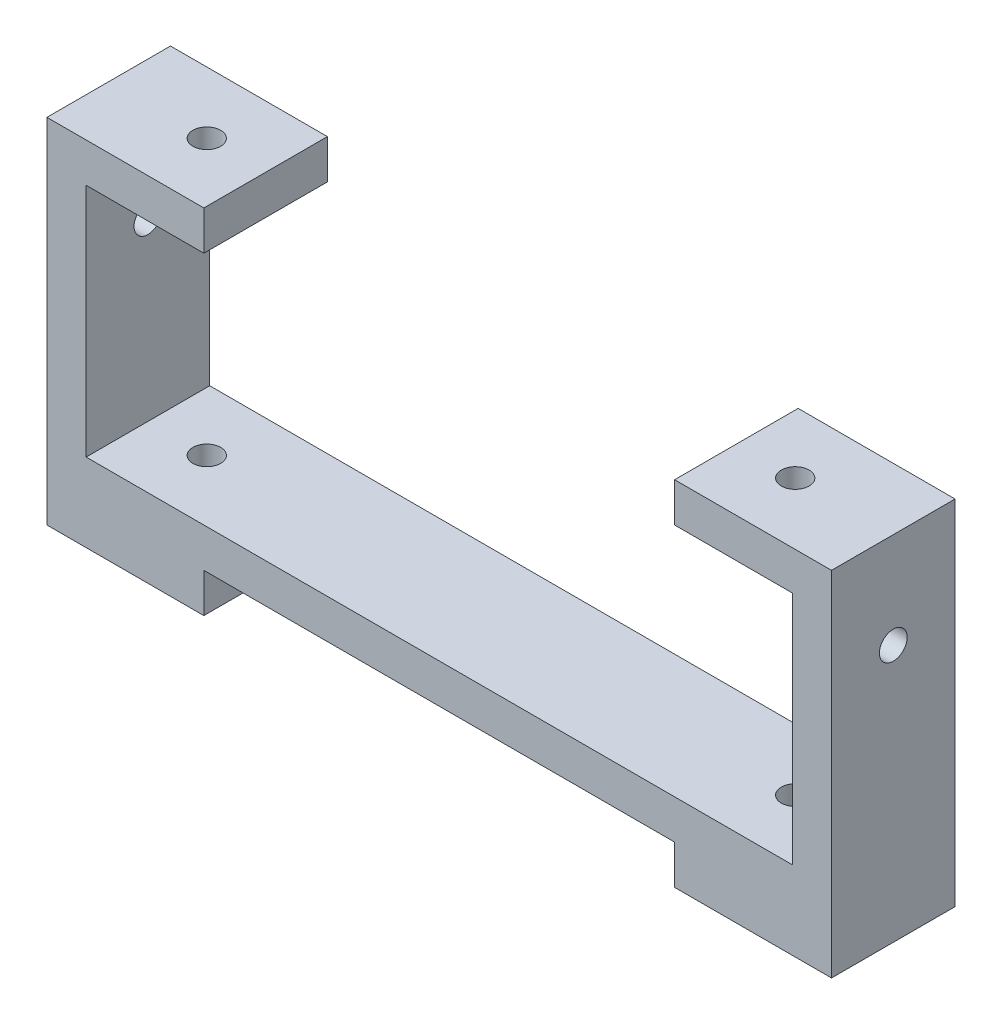
from build123d import *

# Parameters (mm, degrees)
BOSS_EXTRUDE1_DEPTH = 10
CUT_EXTRUDE1_REACH  = 80.154
SKETCH2_R           = 2.25
CUT_EXTRUDE2_REACH  = 130.406
SKETCH3_R           = 2.25
CUT_EXTRUDE3_REACH  = 83.932
SKETCH4_R           = 2.25
CUT_EXTRUDE4_REACH  = 130.406
SKETCH5_R           = 2.25


with BuildPart() as part:
    # Sketch1 → Boss-Extrude1 (new, symmetric)
    with BuildSketch(Plane.XY):
        Polygon((-57.15, -1.651), (-57.15, 36.449), (-38.1, 36.449), (-38.1, 42.799), (-63.5, 42.799), (-63.5, -3.175), (-63.5, -14.351), (-38.1, -14.351), (-38.1, -8.001), (38.1, -8.001), (38.1, -14.351), (63.5, -14.351), (63.5, -3.175), (63.5, 42.799), (38.1, 42.799), (38.1, 36.449), (57.15, 36.449), (57.15, -1.651), align=None)
    extrude(amount=BOSS_EXTRUDE1_DEPTH, both=True)

    # Sketch2 → Cut-Extrude1 (cut, up to next)
    with BuildSketch(Plane(origin=(0, -1.651, 0), x_dir=(1, 0, 0), z_dir=(0, 1, 0)), mode=Mode.PRIVATE) as cut_extrude1_sk1:
        with Locations(Location((-47.625, 0, 0), (0, 0, 270))):
            Circle(SKETCH2_R)
    cut_extrude1_tool1 = extrude(cut_extrude1_sk1.sketch, amount=-CUT_EXTRUDE1_REACH, mode=Mode.PRIVATE) & part.part
    # Sketch2 → Cut-Extrude1 (cut, up to next)
    with BuildSketch(Plane(origin=(0, -1.651, 0), x_dir=(1, 0, 0), z_dir=(0, 1, 0)), mode=Mode.PRIVATE) as cut_extrude1_sk2:
        with Locations(Location((47.625, 0, 0), (0, 0, 180))):
            Circle(SKETCH2_R)
    cut_extrude1_tool2 = extrude(cut_extrude1_sk2.sketch, amount=-CUT_EXTRUDE1_REACH, mode=Mode.PRIVATE) & part.part
    add(cut_extrude1_tool1.solids().sort_by_distance((-47.625, -1.651, 0))[0], mode=Mode.SUBTRACT)
    add(cut_extrude1_tool2.solids().sort_by_distance((47.625, -1.651, 0))[0], mode=Mode.SUBTRACT)

    # Sketch3 → Cut-Extrude2 (cut, up to next)
    with BuildSketch(Plane(origin=(-57.15, 0, 0), x_dir=(0, 0, -1), z_dir=(1, 0, 0)), mode=Mode.PRIVATE) as cut_extrude2_sk1:
        with Locations(Location((0, 26.797, 0), (0, 0, 90))):
            Circle(SKETCH3_R)
    cut_extrude2_tool1 = extrude(cut_extrude2_sk1.sketch, amount=-CUT_EXTRUDE2_REACH, mode=Mode.PRIVATE) & part.part
    add(cut_extrude2_tool1.solids().sort_by_distance((-57.15, 26.797, 0))[0], mode=Mode.SUBTRACT)

    # Sketch4 → Cut-Extrude3 (cut, up to next)
    with BuildSketch(Plane.XZ.offset(-36.449), mode=Mode.PRIVATE) as cut_extrude3_sk1:
        with Locations(Location((-47.625, 0, 0), (0, 0, 90))):
            Circle(SKETCH4_R)
    cut_extrude3_tool1 = extrude(cut_extrude3_sk1.sketch, amount=-CUT_EXTRUDE3_REACH, mode=Mode.PRIVATE) & part.part
    # Sketch4 → Cut-Extrude3 (cut, up to next)
    with BuildSketch(Plane.XZ.offset(-36.449), mode=Mode.PRIVATE) as cut_extrude3_sk2:
        with Locations(Location((47.625, 0, 0), (0, 0, 180))):
            Circle(SKETCH4_R)
    cut_extrude3_tool2 = extrude(cut_extrude3_sk2.sketch, amount=-CUT_EXTRUDE3_REACH, mode=Mode.PRIVATE) & part.part
    add(cut_extrude3_tool1.solids().sort_by_distance((-47.625, 36.449, 0))[0], mode=Mode.SUBTRACT)
    add(cut_extrude3_tool2.solids().sort_by_distance((47.625, 36.449, 0))[0], mode=Mode.SUBTRACT)

    # Sketch5 → Cut-Extrude4 (cut, up to next)
    with BuildSketch(Plane.ZY.offset(-57.15), mode=Mode.PRIVATE) as cut_extrude4_sk1:
        with Locations((0, 27.305)):
            Circle(SKETCH5_R)
    cut_extrude4_tool1 = extrude(cut_extrude4_sk1.sketch, amount=-CUT_EXTRUDE4_REACH, mode=Mode.PRIVATE) & part.part
    add(cut_extrude4_tool1.solids().sort_by_distance((57.15, 27.305, 0))[0], mode=Mode.SUBTRACT)


solid = part.part
